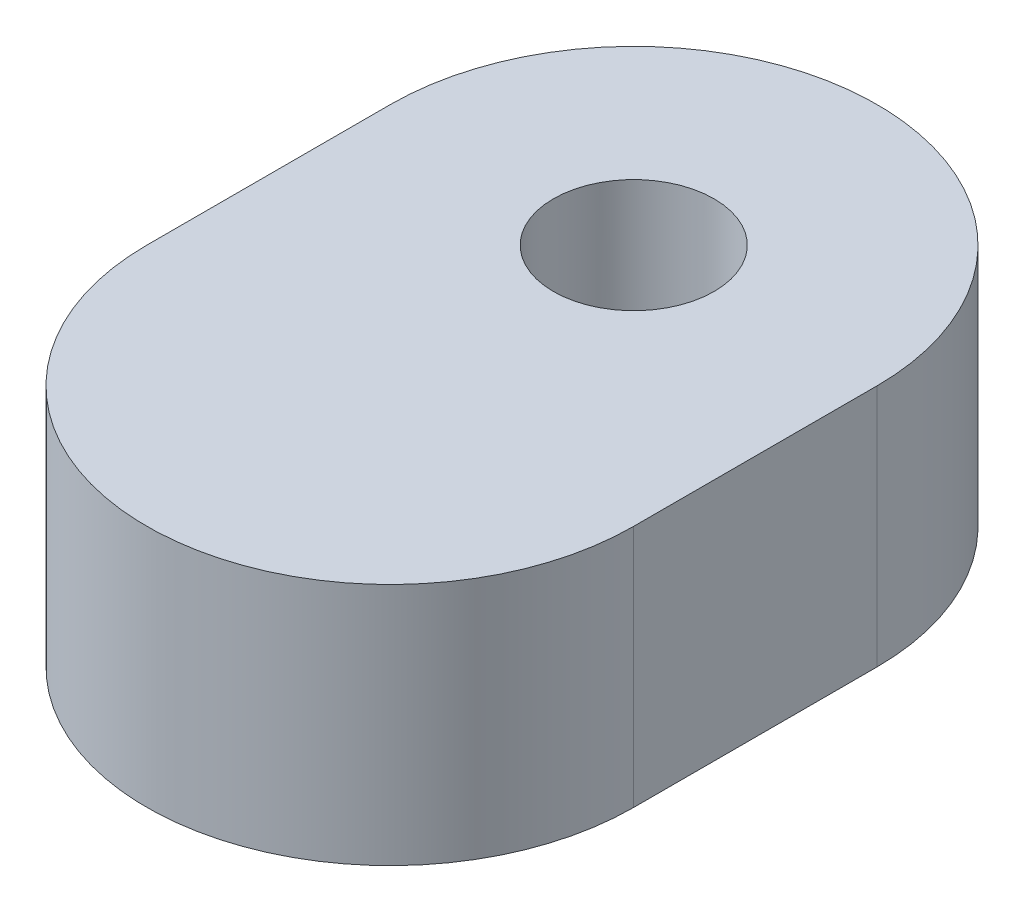
from build123d import *

# Parameters (mm, degrees)
SKETCH1_R           = 3.3
BOSS_EXTRUDE1_DEPTH = 10
CUT_EXTRUDE1_DEPTH  = 5


with BuildPart() as part:
    # Sketch1 → Boss-Extrude1 (new body)
    with BuildSketch(Plane(origin=(0, 0, 0), x_dir=(1, 0, 0), z_dir=(0, 1, 0))):
        with BuildLine():
            Line((10, 0), (10, -10))
            ThreePointArc((10, -10), (0, -20), (-10, -10))
            Line((-10, -10), (-10, 0))
            ThreePointArc((-10, 0), (0, 10), (10, 0))
        make_face()
        with Locations(Location((0, 0, 0), (0, 0, 270))):
            Circle(SKETCH1_R, mode=Mode.SUBTRACT)
    extrude(amount=BOSS_EXTRUDE1_DEPTH)

    # Sketch2 → Cut-Extrude1 (cut)
    with BuildSketch(Plane.XZ):
        Polygon((6.5, 3.75277675), (0, 7.505553499), (-6.5, 3.75277675), (-6.5, -3.75277675), (0, -7.505553499), (6.5, -3.75277675), align=None)
    extrude(amount=-CUT_EXTRUDE1_DEPTH, mode=Mode.SUBTRACT)


solid = part.part
